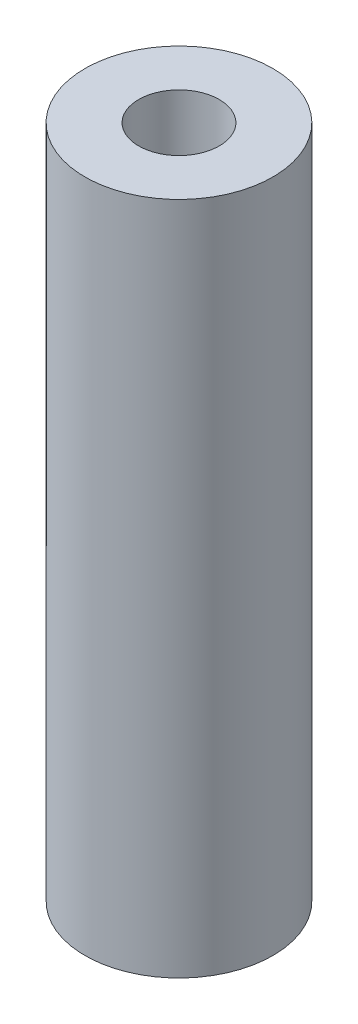
from build123d import *

# Parameters (mm, degrees)
SKETCH1_R           = 4
SKETCH1_R_2         = 1.7145
BOSS_EXTRUDE1_DEPTH = 28.699968


with BuildPart() as part:
    # Sketch1 → Boss-Extrude1 (new body)
    with BuildSketch(Plane(origin=(0, 0, 0), x_dir=(1, 0, 0), z_dir=(0, 1, 0))):
        with Locations(Location((0, 0, 0), (0, 0, 90))):
            Circle(SKETCH1_R)
        with Locations(Location((0, 0, 0), (0, 0, 90))):
            Circle(SKETCH1_R_2, mode=Mode.SUBTRACT)
    extrude(amount=BOSS_EXTRUDE1_DEPTH)


solid = part.part
